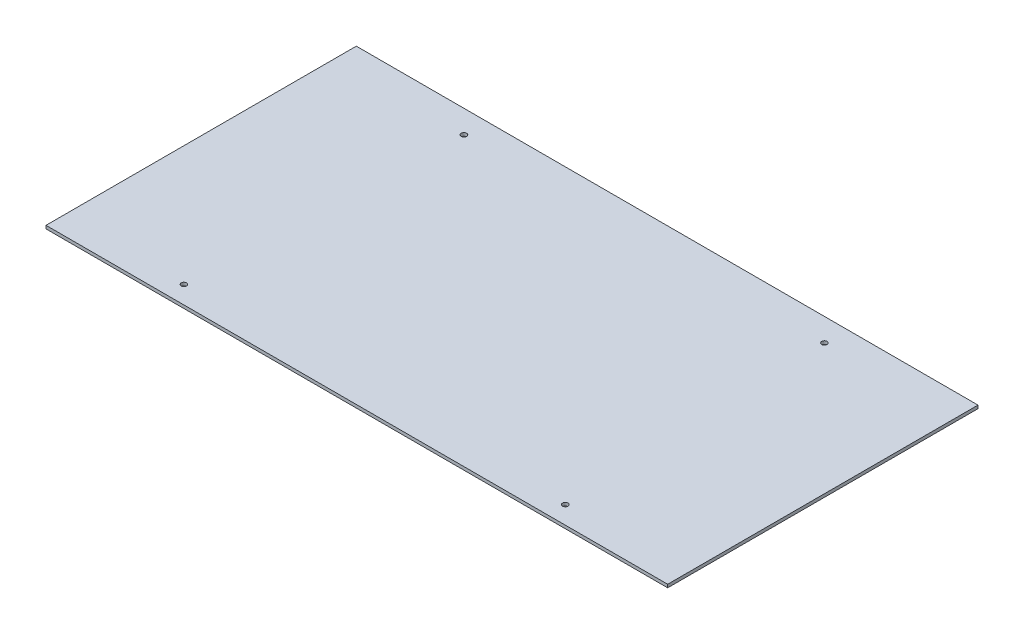
from build123d import *

# Parameters (mm, degrees)
SKETCH1_W               = 595
SKETCH1_H               = 297
BOSS_EXTRUDE1_DEPTH     = 3
CUT_EXTRUDE1_DEPTH      = 333.516916863
CUT_EXTRUDE1_DEPTH_BACK = 333.516916863
SKETCH2_R               = 2.6
CUT_EXTRUDE2_DEPTH      = 333.516916863
CUT_EXTRUDE2_DEPTH_BACK = 333.516916863
SKETCH3_R               = 2.6


with BuildPart() as part:
    # Sketch1 → Boss-Extrude1 (new body)
    with BuildSketch(Plane(origin=(0, 0, 0), x_dir=(1, 0, 0), z_dir=(0, 1, 0))):
        Rectangle(SKETCH1_W, SKETCH1_H)
    extrude(amount=BOSS_EXTRUDE1_DEPTH)

    # Sketch2 → Cut-Extrude1 (cut, two sides: drawn at the far end of the back side and taken through both)
    with BuildSketch(Plane.XZ.offset(-CUT_EXTRUDE1_DEPTH_BACK)):
        with Locations(Location((182.5, 131.5, 0), (0, 0, 270))):
            Circle(SKETCH2_R)
        with Locations(Location((-182.5, 131.5, 0), (0, 0, 270))):
            Circle(SKETCH2_R)
    extrude(amount=CUT_EXTRUDE1_DEPTH + CUT_EXTRUDE1_DEPTH_BACK, mode=Mode.SUBTRACT)

    # Sketch3 → Cut-Extrude2 (cut, two sides: drawn at the far end of the back side and taken through both)
    with BuildSketch(Plane(origin=(0, 0, 0), x_dir=(-1, 0, 0), z_dir=(0, -1, 0)).offset(-CUT_EXTRUDE2_DEPTH_BACK)):
        with Locations(Location((-172.5, 126.5, 0), (0, 0, 90))):
            Circle(SKETCH3_R)
        with Locations(Location((172.5, 126.5, 0), (0, 0, 90))):
            Circle(SKETCH3_R)
    extrude(amount=CUT_EXTRUDE2_DEPTH + CUT_EXTRUDE2_DEPTH_BACK, mode=Mode.SUBTRACT)


solid = part.part
